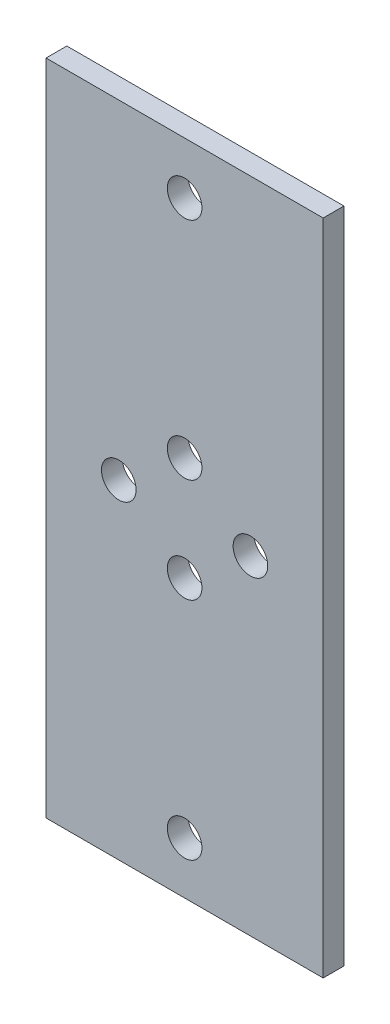
from build123d import *

# Parameters (mm, degrees)
ESBO_O1_W                = 40
ESBO_O1_H                = 95
RESSALTO_EXTRUS_O1_DEPTH = 3
CUT_EXTRUDE1_REACH       = 105.121
ESBO_O2_R                = 2.5


with BuildPart() as part:
    # Esboço1 → Ressalto-extrusão1 (new body)
    with BuildSketch(Plane.XY):
        with Locations((20, 47.5)):
            Rectangle(ESBO_O1_W, ESBO_O1_H)
    extrude(amount=RESSALTO_EXTRUS_O1_DEPTH)

    # Esboço2 → Cut-Extrude1 (cut, up to next)
    with BuildSketch(Plane.XY.offset(3), mode=Mode.PRIVATE) as cut_extrude1_sk1:
        with Locations((20, 87.5)):
            Circle(ESBO_O2_R)
    cut_extrude1_tool1 = extrude(cut_extrude1_sk1.sketch, amount=-CUT_EXTRUDE1_REACH, mode=Mode.PRIVATE) & part.part
    # Esboço2 → Cut-Extrude1 (cut, up to next)
    with BuildSketch(Plane.XY.offset(3), mode=Mode.PRIVATE) as cut_extrude1_sk2:
        with Locations((20, 7.5)):
            Circle(ESBO_O2_R)
    cut_extrude1_tool2 = extrude(cut_extrude1_sk2.sketch, amount=-CUT_EXTRUDE1_REACH, mode=Mode.PRIVATE) & part.part
    # Esboço2 → Cut-Extrude1 (cut, up to next)
    with BuildSketch(Plane.XY.offset(3), mode=Mode.PRIVATE) as cut_extrude1_sk3:
        with Locations((10.5, 47.5)):
            Circle(ESBO_O2_R)
    cut_extrude1_tool3 = extrude(cut_extrude1_sk3.sketch, amount=-CUT_EXTRUDE1_REACH, mode=Mode.PRIVATE) & part.part
    # Esboço2 → Cut-Extrude1 (cut, up to next)
    with BuildSketch(Plane.XY.offset(3), mode=Mode.PRIVATE) as cut_extrude1_sk4:
        with Locations((29.5, 47.5)):
            Circle(ESBO_O2_R)
    cut_extrude1_tool4 = extrude(cut_extrude1_sk4.sketch, amount=-CUT_EXTRUDE1_REACH, mode=Mode.PRIVATE) & part.part
    # Esboço2 → Cut-Extrude1 (cut, up to next)
    with BuildSketch(Plane.XY.offset(3), mode=Mode.PRIVATE) as cut_extrude1_sk5:
        with Locations((20, 55)):
            Circle(ESBO_O2_R)
    cut_extrude1_tool5 = extrude(cut_extrude1_sk5.sketch, amount=-CUT_EXTRUDE1_REACH, mode=Mode.PRIVATE) & part.part
    # Esboço2 → Cut-Extrude1 (cut, up to next)
    with BuildSketch(Plane.XY.offset(3), mode=Mode.PRIVATE) as cut_extrude1_sk6:
        with Locations((20, 40)):
            Circle(ESBO_O2_R)
    cut_extrude1_tool6 = extrude(cut_extrude1_sk6.sketch, amount=-CUT_EXTRUDE1_REACH, mode=Mode.PRIVATE) & part.part
    add(cut_extrude1_tool1.solids().sort_by_distance((20, 87.5, 3))[0], mode=Mode.SUBTRACT)
    add(cut_extrude1_tool2.solids().sort_by_distance((20, 7.5, 3))[0], mode=Mode.SUBTRACT)
    add(cut_extrude1_tool3.solids().sort_by_distance((10.5, 47.5, 3))[0], mode=Mode.SUBTRACT)
    add(cut_extrude1_tool4.solids().sort_by_distance((29.5, 47.5, 3))[0], mode=Mode.SUBTRACT)
    add(cut_extrude1_tool5.solids().sort_by_distance((20, 55, 3))[0], mode=Mode.SUBTRACT)
    add(cut_extrude1_tool6.solids().sort_by_distance((20, 40, 3))[0], mode=Mode.SUBTRACT)


solid = part.part
